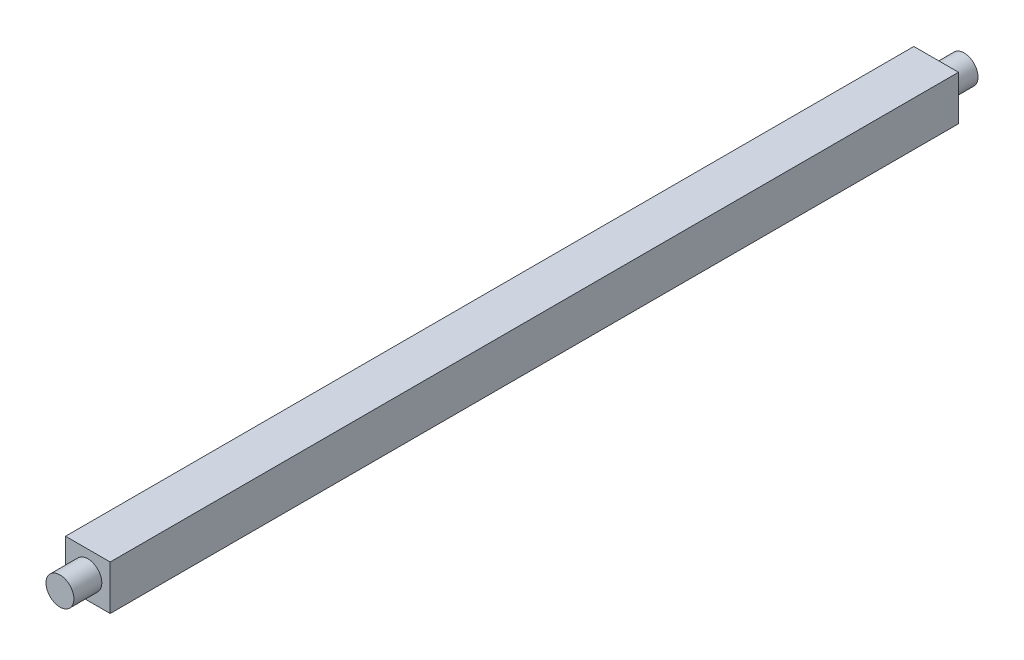
from build123d import *

# Parameters (mm, degrees)
CROQUIS1_W              = 8
CROQUIS1_H              = 8
SALIENTE_EXTRUIR1_DEPTH = 76
CROQUIS2_R              = 2.5
SALIENTE_EXTRUIR2_DEPTH = 5
SALIENTE_EXTRUIR3_START = 5
CROQUIS3_R              = 2.5
SALIENTE_EXTRUIR3_DEPTH = 5


with BuildPart() as part:
    # Croquis1 → Saliente-Extruir1 (new, symmetric)
    with BuildSketch(Plane.XY):
        Rectangle(CROQUIS1_W, CROQUIS1_H)
    extrude(amount=SALIENTE_EXTRUIR1_DEPTH, both=True)

    # Croquis2 → Saliente-Extruir2 (add)
    with BuildSketch(Plane.XY.offset(76)):
        with Locations(Location((0, 0, 0), (0, 0, 180))):
            Circle(CROQUIS2_R)
    extrude(amount=SALIENTE_EXTRUIR2_DEPTH)

    # Croquis3 → Saliente-Extruir3 (add)
    with BuildSketch(Plane(origin=(0, 0, -76), x_dir=(-1, 0, 0), z_dir=(0, 0, -1)).offset(SALIENTE_EXTRUIR3_START)):
        Circle(CROQUIS3_R)
    extrude(amount=-SALIENTE_EXTRUIR3_DEPTH)


solid = part.part
